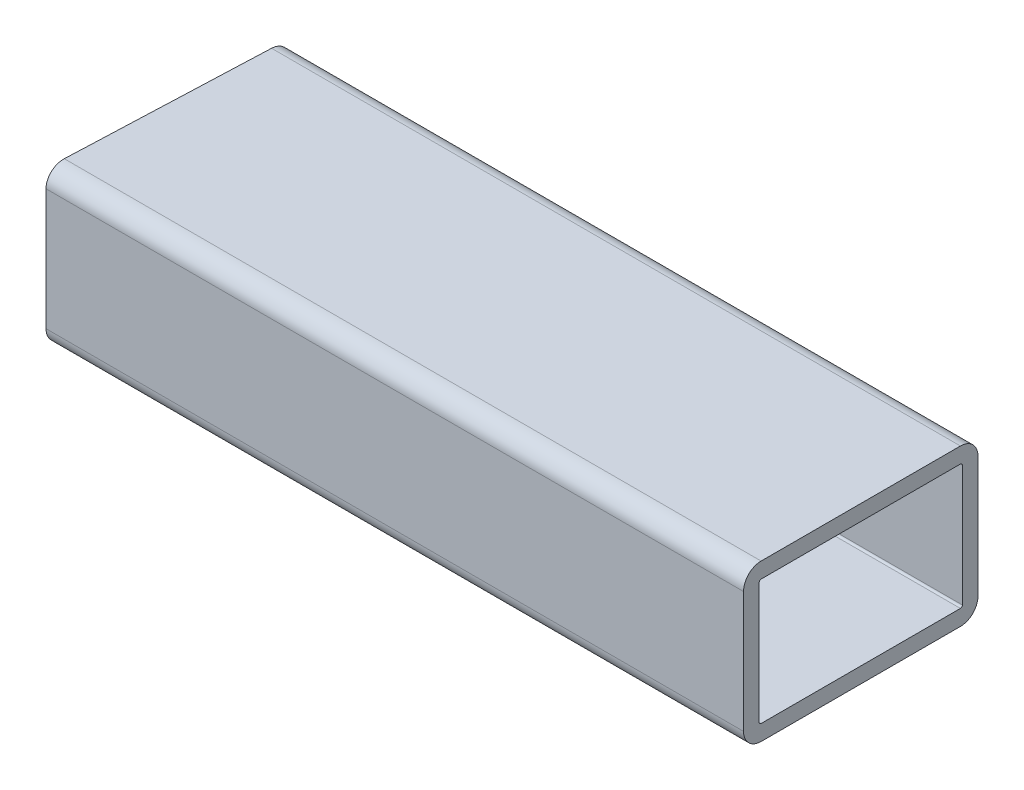
from build123d import *

# Parameters (mm, degrees)
TUBO_RECTANGULAR_60X40X4_DEPTH = 178.5
CORTAR_EXTRUIR1_DEPTH          = 186.370574795


with BuildPart() as part:
    # Sketch1 → Tubo rectangular 60X40X4 (new body)
    with BuildSketch(Plane.YZ):
        with BuildLine():
            Line((-15.5, -30), (15.5, -30))
            ThreePointArc((15.5, -30), (18.681980515, -28.681980515), (20, -25.5))
            Line((20, -25.5), (20, 25.5))
            ThreePointArc((20, 25.5), (18.681980515, 28.681980515), (15.5, 30))
            Line((15.5, 30), (-15.5, 30))
            ThreePointArc((-15.5, 30), (-18.681980515, 28.681980515), (-20, 25.5))
            Line((-20, 25.5), (-20, -25.5))
            ThreePointArc((-20, -25.5), (-18.681980515, -28.681980515), (-15.5, -30))
        make_face()
        with BuildLine():
            Line((-15.5, -26), (15.5, -26))
            ThreePointArc((15.5, -26), (15.853553391, -25.853553391), (16, -25.5))
            Line((16, -25.5), (16, 25.5))
            ThreePointArc((16, 25.5), (15.853553391, 25.853553391), (15.5, 26))
            Line((15.5, 26), (-15.5, 26))
            ThreePointArc((-15.5, 26), (-15.853553391, 25.853553391), (-16, 25.5))
            Line((-16, 25.5), (-16, -25.5))
            ThreePointArc((-16, -25.5), (-15.853553391, -25.853553391), (-15.5, -26))
        make_face(mode=Mode.SUBTRACT)
    extrude(amount=TUBO_RECTANGULAR_60X40X4_DEPTH)

    # Croquis4 → Cortar-Extruir1 (cut, through all)
    with BuildSketch(Plane(origin=(0, 20, 0), x_dir=(1, 0, 0), z_dir=(0, 1, 0))):
        Polygon((0, -30), (2.4, 30), (0, 30), align=None)
    extrude(amount=-CORTAR_EXTRUIR1_DEPTH, mode=Mode.SUBTRACT)


solid = part.part
